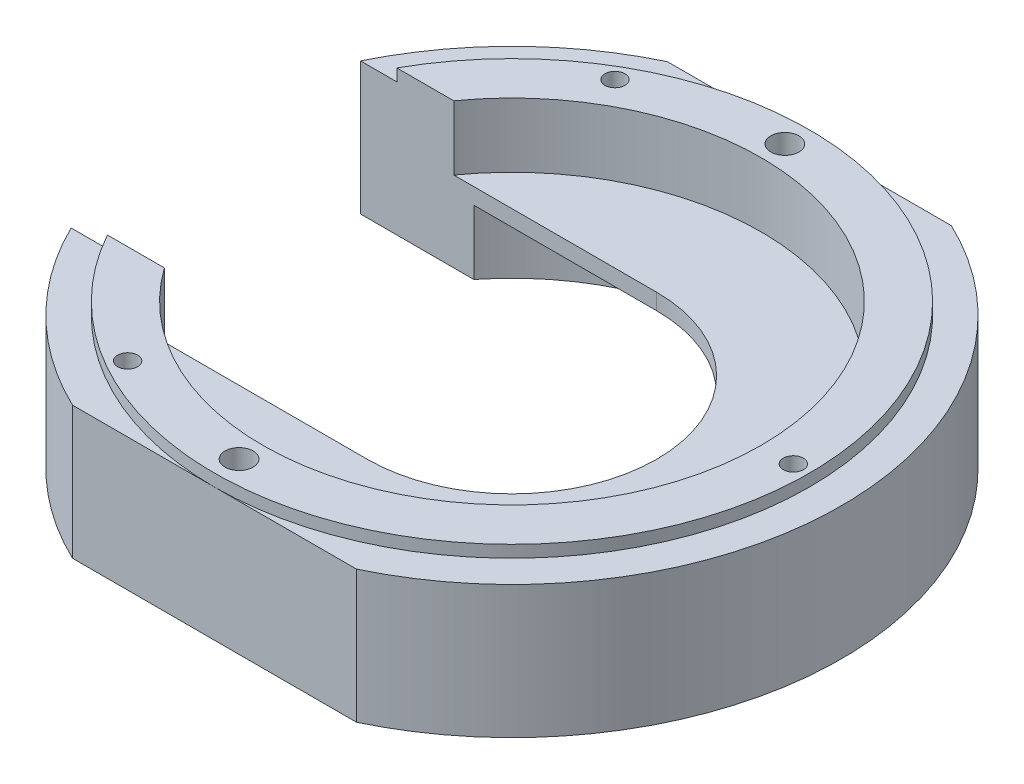
from build123d import *

# Parameters (mm, degrees)
BOSS_EXTRUDE3_DEPTH = 16.5
BOSS_EXTRUDE5_DEPTH = 1.5
SKETCH13_R          = 31
CUT_EXTRUDE1_DEPTH  = 8
SKETCH14_R          = 29
CUT_EXTRUDE2_DEPTH  = 8
M3_TAPPED_HOLE1_D   = 2.5
CIRPATTERN1_COUNT   = 3
HOLE1_D             = 3.5
HOLE1_DEPTH         = 18
HOLE1_CBORE_D       = 6
HOLE1_CBORE_DEPTH   = 4
CIRPATTERN2_COUNT   = 2


with BuildPart() as part:
    # Sketch7 → Boss-Extrude3 (new body)
    with BuildSketch(Plane(origin=(0, 0, 0), x_dir=(1, 0, 0), z_dir=(0, 1, 0))):
        with BuildLine():
            Line((17.663521733, 37), (-17.663521733, 37))
            ThreePointArc((-17.663521733, 37), (-28.858964332, 29.123189689), (-36.837480913, 18))
            Line((-36.837480913, 18), (3.3e-08, 18))
            Line((3.3e-08, 18), (36.837480913, 18))
            ThreePointArc((36.837480913, 18), (28.858964332, 29.123189689), (17.663521733, 37))
        make_face()
        with BuildLine():
            Line((0, -18), (36.837480913, -18))
            Line((36.837480913, -18), (36.837480913, 18))
            Line((36.837480913, 18), (3.3e-08, 18))
            ThreePointArc((3.3e-08, 18), (12.727922073, 12.72792205), (18, 0))
            ThreePointArc((18, 0), (12.727922061, -12.727922061), (0, -18))
        make_face()
        with BuildLine():
            Line((36.837480913, 18), (36.837480913, -18))
            ThreePointArc((36.837480913, -18), (39.945817787, -9.237512722), (41, 0))
            ThreePointArc((41, 0), (39.945817787, 9.237512722), (36.837480913, 18))
        make_face()
        with BuildLine():
            ThreePointArc((-36.837480913, -18), (-28.858964332, -29.123189689), (-17.663521733, -37))
            Line((-17.663521733, -37), (17.663521733, -37))
            ThreePointArc((17.663521733, -37), (28.858964332, -29.123189689), (36.837480913, -18))
            Line((36.837480913, -18), (0, -18))
            Line((0, -18), (-36.837480913, -18))
        make_face()
    extrude(amount=BOSS_EXTRUDE3_DEPTH)

    # Sketch11 → Boss-Extrude5 (add)
    with BuildSketch(Plane(origin=(0, 16.5, 0), x_dir=(1, 0, 0), z_dir=(0, 1, 0))):
        with BuildLine():
            Line((-32.32645975, 18), (0, 18))
            ThreePointArc((0, 18), (12.727922061, 12.727922061), (18, 0))
            ThreePointArc((18, 0), (12.727922061, -12.727922061), (0, -18))
            Line((0, -18), (-32.32645975, -18))
            ThreePointArc((-32.32645975, -18), (9.298413554, -35.812560721), (37, 0))
            ThreePointArc((37, 0), (9.298413554, 35.812560721), (-32.32645975, 18))
        make_face()
    extrude(amount=BOSS_EXTRUDE5_DEPTH)

    # Sketch13 → Cut-Extrude1 (cut)
    with BuildSketch(Plane(origin=(0, 18, 0), x_dir=(1, 0, 0), z_dir=(0, 1, 0))):
        Circle(SKETCH13_R)
    extrude(amount=-CUT_EXTRUDE1_DEPTH, mode=Mode.SUBTRACT)

    # Sketch14 → Cut-Extrude2 (cut)
    with BuildSketch(Plane.XZ):
        Circle(SKETCH14_R)
    extrude(amount=-CUT_EXTRUDE2_DEPTH, mode=Mode.SUBTRACT)

    # M3 Tapped Hole1 (through all)
    with Locations(Plane(origin=(35, 0, 0), x_dir=(0, 0, -1), z_dir=(0, -1, 0))):
        with Locations((0, 0)):
            m3_tapped_hole1 = Hole(M3_TAPPED_HOLE1_D / 2)

    # CirPattern1: M3 Tapped Hole1 ×3 about axis
    cirpattern1_axis = Axis((0, 0, 0), (0, 1, 0))
    for i in range(1, CIRPATTERN1_COUNT):
        add(m3_tapped_hole1.rotate(cirpattern1_axis, i * 360 / CIRPATTERN1_COUNT), mode=Mode.SUBTRACT)

    # Hole1
    with Locations(Plane(origin=(0, 0, 33.95), x_dir=(0, 0, -1), z_dir=(0, -1, 0))):
        with Locations((0, 0), (30.604436826, -13.912164411)):
            hole1 = CounterBoreHole(HOLE1_D / 2, HOLE1_CBORE_D / 2, HOLE1_CBORE_DEPTH, depth=HOLE1_DEPTH)

    # CirPattern2: Hole1 ×2 about axis
    cirpattern2_axis = Axis((0, 0, 0), (0, 1, 0))
    for i in range(1, CIRPATTERN2_COUNT):
        add(hole1.rotate(cirpattern2_axis, i * 360 / CIRPATTERN2_COUNT), mode=Mode.SUBTRACT)


solid = part.part
